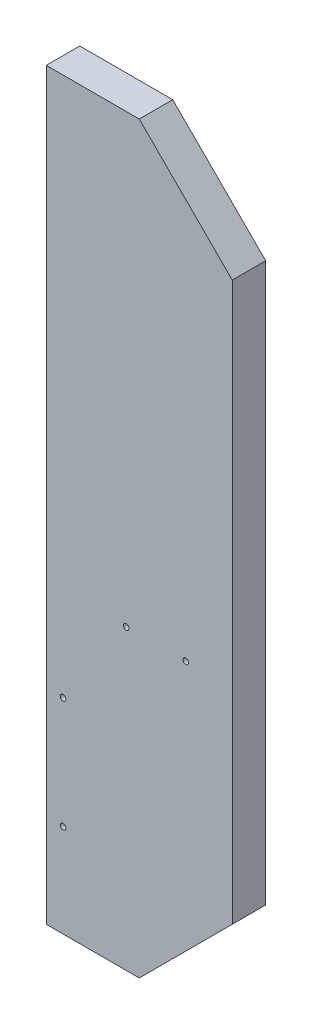
from build123d import *

# Parameters (mm, degrees)
ESBO_O6_W                = 100
ESBO_O6_H                = 400
RESSALTO_EXTRUS_O2_DEPTH = 18
CORTE_EXTRUS_O2_DEPTH    = 413.703283244
ESBO_O8_R                = 1.5
CORTE_EXTRUS_O3_DEPTH    = 413.703283244


with BuildPart() as part:
    # Esboço6 → Ressalto-extrusão2 (new body)
    with BuildSketch(Plane.XY):
        with Locations((50, 200)):
            Rectangle(ESBO_O6_W, ESBO_O6_H)
    extrude(amount=RESSALTO_EXTRUS_O2_DEPTH)

    # Esboço7 → Corte-extrusão2 (cut, through all)
    with BuildSketch(Plane.XY.offset(18)):
        Polygon((50, 400), (100, 350), (100, 400), align=None)
        Polygon((100, 50), (50, 0), (100, 0), align=None)
    extrude(amount=-CORTE_EXTRUS_O2_DEPTH, mode=Mode.SUBTRACT)

    # Esboço8 → Corte-extrusão3 (cut, through all)
    with BuildSketch(Plane(origin=(0, 0, 0), x_dir=(-1, 0, 0), z_dir=(0, 0, -1))):
        with Locations((-75, 160)):
            Circle(ESBO_O8_R)
        with Locations((-43, 160)):
            Circle(ESBO_O8_R)
        with Locations((-9, 50)):
            Circle(ESBO_O8_R)
        with Locations((-9, 110)):
            Circle(ESBO_O8_R)
    extrude(amount=-CORTE_EXTRUS_O3_DEPTH, mode=Mode.SUBTRACT)


solid = part.part
